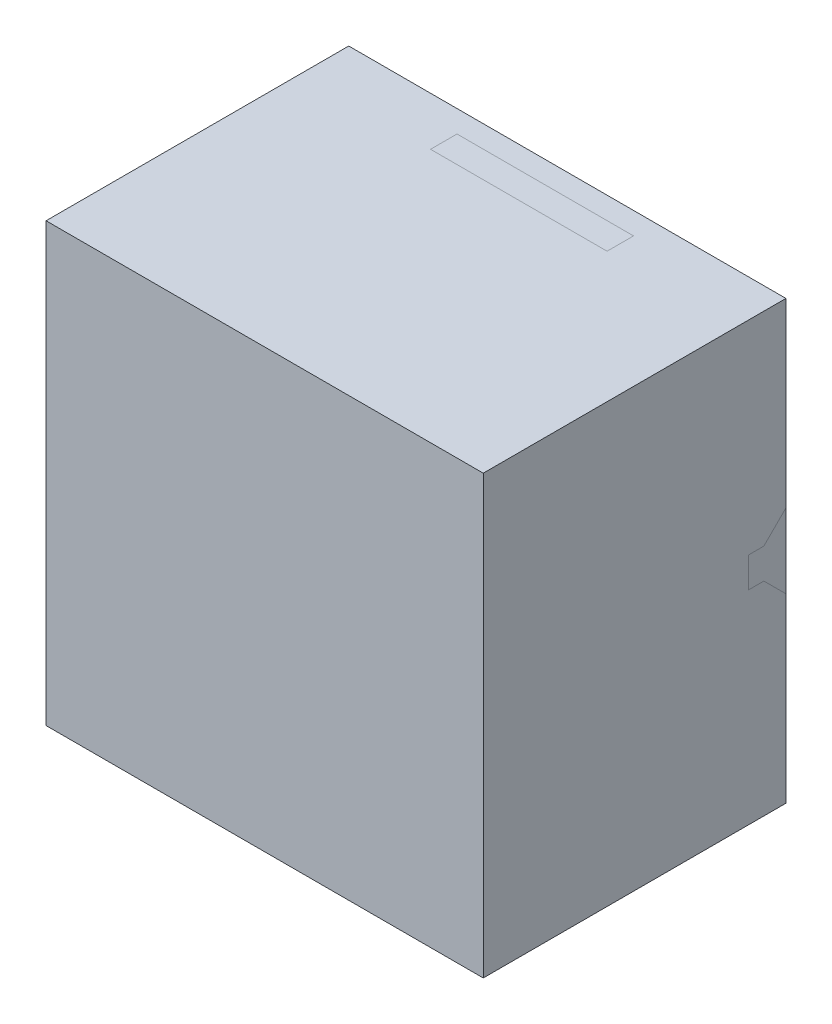
from build123d import *

# Parameters (mm, degrees)
SKETCH1_W           = 99.06
SKETCH1_H           = 99.06
BOSS_EXTRUDE1_DEPTH = 68.58


with BuildPart() as part:
    # Sketch1 → Boss-Extrude1 (new body)
    with BuildSketch(Plane.XY):
        Rectangle(SKETCH1_W, SKETCH1_H)
    extrude(amount=BOSS_EXTRUDE1_DEPTH)


solid = part.part
